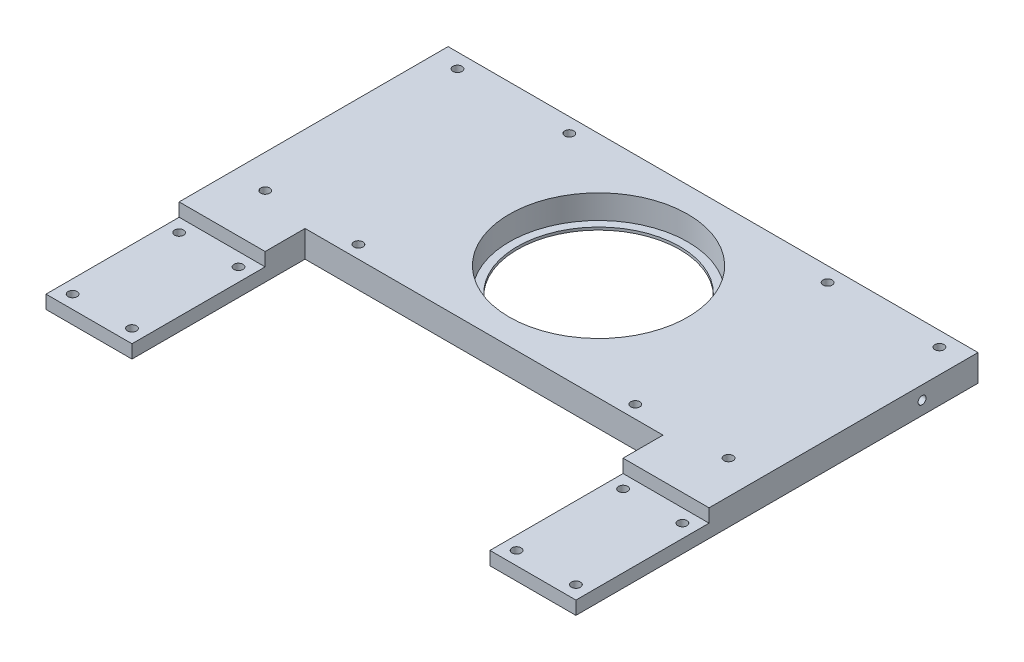
from build123d import *

# Parameters (mm, degrees)
SKIZZE1_W                        = 199
SKIZZE1_H                        = 400
AUFSATZ_LINEAR_AUSTRAGEN1_DEPTH  = 10
SKIZZE5_W                        = 199
SKIZZE5_H                        = 95
SCHNITT_LINEAR_AUSTRAGEN2_DEPTH  = 10
SKIZZE6_R                        = 1.7
SCHNITT_LINEAR_AUSTRAGEN3_DEPTH  = 224.607356766
SCHNITT_LINEAR_AUSTRAGEN4_DEPTH  = 4
SKIZZE16_W                       = 35
SKIZZE16_H                       = 7
SCHNITT_LINEAR_AUSTRAGEN10_DEPTH = 5
SCHNITT_LINEAR_AUSTRAGEN11_DEPTH = 35
SKIZZE20_R                       = 1.7
SCHNITT_LINEAR_AUSTRAGEN12_DEPTH = 224.607356766
SKIZZE21_W                       = 134.422077922
SKIZZE21_H                       = 65
SCHNITT_LINEAR_AUSTRAGEN13_DEPTH = 224.607356766
SCHNITT_LINEAR_AUSTRAGEN14_DEPTH = 224.607356766
AUFSATZ_LINEAR_AUSTRAGEN6_DEPTH  = 10
SKIZZE25_R                       = 1.7
SCHNITT_LINEAR_AUSTRAGEN15_DEPTH = 224.607356766
SCHNITT_LINEAR_AUSTRAGEN16_DEPTH = 283.313655355
SKIZZE27_R                       = 33.5
SCHNITT_LINEAR_AUSTRAGEN17_DEPTH = 146.000862066
SKIZZE28_R                       = 36.006256149
SKIZZE28_R_2                     = 30.5
AUFSATZ_LINEAR_AUSTRAGEN7_DEPTH  = 1
SKIZZE29_R                       = 1.5
SCHNITT_LINEAR_AUSTRAGEN18_DEPTH = 10
SKIZZE30_R                       = 1.5
SCHNITT_LINEAR_AUSTRAGEN19_DEPTH = 10
SKIZZE31_R                       = 2.95
SCHNITT_LINEAR_AUSTRAGEN20_DEPTH = 3.5


with BuildPart() as part:
    # Skizze1 → Aufsatz-Linear austragen1 (new body)
    with BuildSketch(Plane(origin=(0, 0, 0), x_dir=(1, 0, 0), z_dir=(0, 1, 0))):
        Rectangle(SKIZZE1_W, SKIZZE1_H)
    extrude(amount=AUFSATZ_LINEAR_AUSTRAGEN1_DEPTH)

    # Skizze5 → Schnitt-Linear austragen2 (cut)
    with BuildSketch(Plane(origin=(0, 10, 0), x_dir=(1, 0, 0), z_dir=(0, 1, 0))):
        Polygon((99.5, -200), (18, -200), (99.5, -46), align=None)
        Polygon((-18, -200), (-99.5, -46), (-99.5, -200), align=None)
        with Locations((0, 152.5)):
            Rectangle(SKIZZE5_W, SKIZZE5_H)
        Polygon((67.211038961, -46), (-67.211038961, -46), (-2.646103896, -168), (2.646103896, -168), align=None)
    extrude(amount=-SCHNITT_LINEAR_AUSTRAGEN2_DEPTH, mode=Mode.SUBTRACT)

    # Skizze6 → Schnitt-Linear austragen3 (cut, through all)
    with BuildSketch(Plane(origin=(0, 10, 0), x_dir=(1, 0, 0), z_dir=(0, 1, 0))):
        with Locations(Location((-11, -195, 0), (0, 0, 270))):
            Circle(SKIZZE6_R)
        with Locations(Location((-11, -178.18, 0), (0, 0, 90))):
            Circle(SKIZZE6_R)
        with Locations(Location((11, -195, 0), (0, 0, 90))):
            Circle(SKIZZE6_R)
        with Locations(Location((11, -178.18, 0), (0, 0, 270))):
            Circle(SKIZZE6_R)
    extrude(amount=-SCHNITT_LINEAR_AUSTRAGEN3_DEPTH, mode=Mode.SUBTRACT)

    # Skizze7 → Schnitt-Linear austragen4 (cut)
    with BuildSketch(Plane.XZ):
        Polygon((-11, 198.406366588), (-8.05, 196.703183294), (-8.05, 193.296816706), (-11, 191.593633412), (-13.95, 193.296816706), (-13.95, 196.703183294), align=None)
        Polygon((11, 198.406366588), (8.05, 196.703183294), (8.05, 193.296816706), (11, 191.593633412), (13.95, 193.296816706), (13.95, 196.703183294), align=None)
        Polygon((-8.05, 176.476816706), (-8.05, 179.883183294), (-11, 181.586366588), (-13.95, 179.883183294), (-13.95, 176.476816706), (-11, 174.773633412), align=None)
        Polygon((8.05, 176.476816706), (8.05, 179.883183294), (11, 181.586366588), (13.95, 179.883183294), (13.95, 176.476816706), (11, 174.773633412), align=None)
    extrude(amount=-SCHNITT_LINEAR_AUSTRAGEN4_DEPTH, mode=Mode.SUBTRACT)

    # Skizze16 → Schnitt-Linear austragen10 (cut)
    with BuildSketch(Plane.XZ):
        with Locations((0, 186.59)):
            Rectangle(SKIZZE16_W, SKIZZE16_H)
    extrude(amount=-SCHNITT_LINEAR_AUSTRAGEN10_DEPTH, mode=Mode.SUBTRACT)

    # Skizze17 → Schnitt-Linear austragen11 (cut)
    with BuildSketch(Plane.ZY.offset(-17.5)):
        Polygon((183.09, 5), (186.59, 8.5), (190.09, 5), align=None)
    extrude(amount=SCHNITT_LINEAR_AUSTRAGEN11_DEPTH, mode=Mode.SUBTRACT)

    # Skizze20 → Schnitt-Linear austragen12 (cut, through all)
    with BuildSketch(Plane(origin=(0, 10, 0), x_dir=(1, 0, 0), z_dir=(0, 1, 0))):
        with Locations(Location((90.5, 99.52, 0), (0, 0, 270))):
            Circle(SKIZZE20_R)
        with Locations(Location((48.5, 99.52, 0), (0, 0, 270))):
            Circle(SKIZZE20_R)
        with Locations(Location((-48.5, 99.52, 0), (0, 0, 90))):
            Circle(SKIZZE20_R)
        with Locations(Location((-90.5, 99.52, 0), (0, 0, 90))):
            Circle(SKIZZE20_R)
        with Locations(Location((87, 23.82, 0), (0, 0, 270))):
            Circle(SKIZZE20_R)
        with Locations(Location((52, 23.82, 0), (0, 0, 270))):
            Circle(SKIZZE20_R)
        with Locations(Location((-87, 23.82, 0), (0, 0, 90))):
            Circle(SKIZZE20_R)
        with Locations(Location((-52, 23.82, 0), (0, 0, 90))):
            Circle(SKIZZE20_R)
    extrude(amount=-SCHNITT_LINEAR_AUSTRAGEN12_DEPTH, mode=Mode.SUBTRACT)

    # Skizze21 → Schnitt-Linear austragen13 (cut, through all)
    with BuildSketch(Plane(origin=(0, 10, 0), x_dir=(1, 0, 0), z_dir=(0, 1, 0))):
        with Locations((0, -13.5)):
            Rectangle(SKIZZE21_W, SKIZZE21_H)
    extrude(amount=-SCHNITT_LINEAR_AUSTRAGEN13_DEPTH, mode=Mode.SUBTRACT)

    # Skizze22 → Schnitt-Linear austragen14 (cut, through all)
    with BuildSketch(Plane(origin=(0, 10, 0), x_dir=(1, 0, 0), z_dir=(0, 1, 0))):
        with BuildLine():
            Line((-67.211038961, -46), (-2.646103896, -168))
            ThreePointArc((-2.646103896, -168), (-52.825886854, -116.471631215), (-67.211038961, -46))
        make_face()
    schnitt_linear_austragen14 = extrude(amount=-SCHNITT_LINEAR_AUSTRAGEN14_DEPTH, mode=Mode.SUBTRACT)

    # Skizze23 → Aufsatz-Linear austragen6 (add)
    with BuildSketch(Plane(origin=(0, 10, 0), x_dir=(1, 0, 0), z_dir=(0, 1, 0))):
        with BuildLine():
            Line((-99.5, -46), (-18, -200))
            ThreePointArc((-18, -200), (-75.095260266, -131.650251374), (-99.5, -46))
        make_face()
    aufsatz_linear_austragen6 = extrude(amount=-AUFSATZ_LINEAR_AUSTRAGEN6_DEPTH)

    # Spiegeln2: Schnitt-Linear austragen14, Aufsatz-Linear austragen6 across plane
    add(schnitt_linear_austragen14.mirror(Plane(origin=(0, 0, 0), x_dir=(0, 0, 1), z_dir=(1, 0, 0))), mode=Mode.SUBTRACT)
    add(aufsatz_linear_austragen6.mirror(Plane(origin=(0, 0, 0), x_dir=(0, 0, 1), z_dir=(1, 0, 0))))

    # Skizze25 → Schnitt-Linear austragen15 (cut, through all)
    with BuildSketch(Plane(origin=(0, 10, 0), x_dir=(1, 0, 0), z_dir=(0, 1, 0))):
        with Locations(Location((-94.5, -1, 0), (0, 0, 270))):
            Circle(SKIZZE25_R)
        with Locations(Location((-72.211038961, -1, 0), (0, 0, 90))):
            Circle(SKIZZE25_R)
        with Locations(Location((-72.211038961, -41, 0), (0, 0, 270))):
            Circle(SKIZZE25_R)
        with Locations(Location((-94.5, -41, 0), (0, 0, 90))):
            Circle(SKIZZE25_R)
    schnitt_linear_austragen15 = extrude(amount=-SCHNITT_LINEAR_AUSTRAGEN15_DEPTH, mode=Mode.SUBTRACT)

    # Spiegeln3: Schnitt-Linear austragen15 across plane
    add(schnitt_linear_austragen15.mirror(Plane(origin=(0, 0, 0), x_dir=(0, 0, 1), z_dir=(1, 0, 0))), mode=Mode.SUBTRACT)

    # Skizze26 → Schnitt-Linear austragen16 (cut, through all)
    with BuildSketch(Plane.ZY.offset(99.5)):
        Polygon((-4, 5), (-4, 13.101486595), (200.684563047, 82.546277137), (242.997216492, -41.037631402), (91.241487897, -60.284782055), (46, 0), (46, 5), align=None)
    extrude(amount=-SCHNITT_LINEAR_AUSTRAGEN16_DEPTH, mode=Mode.SUBTRACT)

    # Skizze27 → Schnitt-Linear austragen17 (cut, through all)
    with BuildSketch(Plane(origin=(0, 10, 0), x_dir=(1, 0, 0), z_dir=(0, 1, 0))):
        with Locations(Location((0, 62, 0), (0, 0, 270))):
            Circle(SKIZZE27_R)
    extrude(amount=-SCHNITT_LINEAR_AUSTRAGEN17_DEPTH, mode=Mode.SUBTRACT)

    # Skizze28 → Aufsatz-Linear austragen7 (add)
    with BuildSketch(Plane.XZ):
        with Locations((0, -62)):
            Circle(SKIZZE28_R)
        with Locations(Location((0, -62, 0), (0, 0, 270))):
            Circle(SKIZZE28_R_2, mode=Mode.SUBTRACT)
    extrude(amount=-AUFSATZ_LINEAR_AUSTRAGEN7_DEPTH)

    # Skizze29 → Schnitt-Linear austragen18 (cut)
    with BuildSketch(Plane.ZY.offset(99.5)):
        with Locations((-84, 5)):
            Circle(SKIZZE29_R)
    schnitt_linear_austragen18 = extrude(amount=-SCHNITT_LINEAR_AUSTRAGEN18_DEPTH, mode=Mode.SUBTRACT)

    # Skizze30 → Schnitt-Linear austragen19 (cut)
    with BuildSketch(Plane(origin=(0, 0, -105), x_dir=(-1, 0, 0), z_dir=(0, 0, -1))):
        with Locations((94.5, 5)):
            Circle(SKIZZE30_R)
        with Locations((78.5, 5)):
            Circle(SKIZZE30_R)
    schnitt_linear_austragen19 = extrude(amount=-SCHNITT_LINEAR_AUSTRAGEN19_DEPTH, mode=Mode.SUBTRACT)

    # Spiegeln4: Schnitt-Linear austragen18, Schnitt-Linear austragen19 across plane
    add(schnitt_linear_austragen18.mirror(Plane(origin=(0, 0, 0), x_dir=(0, 0, 1), z_dir=(1, 0, 0))), mode=Mode.SUBTRACT)
    add(schnitt_linear_austragen19.mirror(Plane(origin=(0, 0, 0), x_dir=(0, 0, 1), z_dir=(1, 0, 0))), mode=Mode.SUBTRACT)

    # Skizze31 → Schnitt-Linear austragen20 (cut)
    with BuildSketch(Plane.XZ):
        with Locations(Location((-90.5, -99.52, 0), (0, 0, 270))):
            Circle(SKIZZE31_R)
        with Locations(Location((-48.5, -99.52, 0), (0, 0, 270))):
            Circle(SKIZZE31_R)
        with Locations(Location((-87, -23.82, 0), (0, 0, 270))):
            Circle(SKIZZE31_R)
        with Locations(Location((-52, -23.82, 0), (0, 0, 270))):
            Circle(SKIZZE31_R)
        with Locations(Location((52, -23.82, 0), (0, 0, 90))):
            Circle(SKIZZE31_R)
        with Locations(Location((87, -23.82, 0), (0, 0, 90))):
            Circle(SKIZZE31_R)
        with Locations(Location((48.5, -99.52, 0), (0, 0, 90))):
            Circle(SKIZZE31_R)
        with Locations(Location((90.5, -99.52, 0), (0, 0, 90))):
            Circle(SKIZZE31_R)
    extrude(amount=-SCHNITT_LINEAR_AUSTRAGEN20_DEPTH, mode=Mode.SUBTRACT)


solid = part.part
